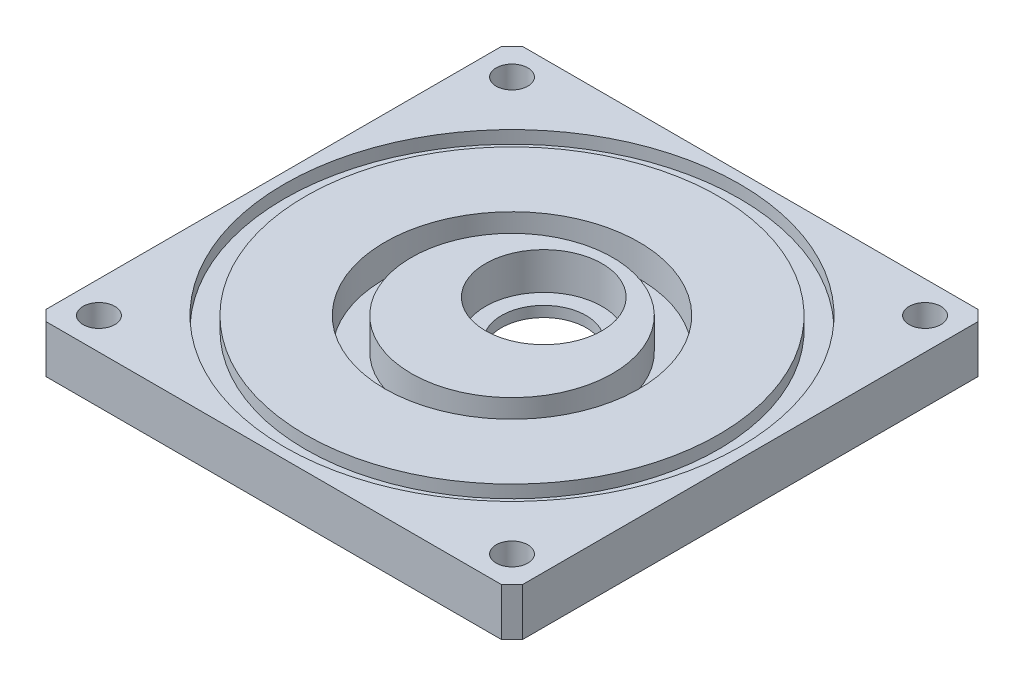
from build123d import *

# Parameters (mm, degrees)
SKETCH_1_W          = 45
SKETCH_1_H          = 45
EXTRUDE_1_DEPTH     = 4.5
SKETCH_2_R          = 5.5
CUT_EXTRUDE_1_DEPTH = 3.5
SKETCH_3_R          = 4
CUT_EXTRUDE_2_DEPTH = 33.011716605
SKETCH_4_R          = 12
SKETCH_4_R_2        = 9.5
CUT_EXTRUDE_3_DEPTH = 3
SKETCH_5_R          = 21.5
SKETCH_5_R_2        = 19.5
CUT_EXTRUDE_4_DEPTH = 1.2
CHAMFER_1_SIZE      = 1
SKETCH_6_R          = 1.5
CUT_EXTRUDE_5_DEPTH = 33.136427928


with BuildPart() as part:
    # 草图1 → 凸台-拉伸1 (new body)
    with BuildSketch(Plane(origin=(0, 0, 0), x_dir=(1, 0, 0), z_dir=(0, 1, 0))):
        Rectangle(SKETCH_1_W, SKETCH_1_H)
    extrude(amount=EXTRUDE_1_DEPTH)

    # 草图2 → 切除-拉伸1 (cut)
    with BuildSketch(Plane(origin=(0, 4.5, 0), x_dir=(1, 0, 0), z_dir=(0, 1, 0))):
        with Locations(Location((0, 3, 0), (0, 0, 270))):
            Circle(SKETCH_2_R)
    extrude(amount=-CUT_EXTRUDE_1_DEPTH, mode=Mode.SUBTRACT)

    # 草图3 → 切除-拉伸2 (cut, through all)
    with BuildSketch(Plane(origin=(0, 1, 0), x_dir=(1, 0, 0), z_dir=(0, 1, 0))):
        with Locations(Location((0, 3, 0), (0, 0, 270))):
            Circle(SKETCH_3_R)
    extrude(amount=-CUT_EXTRUDE_2_DEPTH, mode=Mode.SUBTRACT)

    # 草图4 → 切除-拉伸3 (cut)
    with BuildSketch(Plane(origin=(0, 4.5, 0), x_dir=(1, 0, 0), z_dir=(0, 1, 0))):
        with Locations(Location((0, 0, 0), (0, 0, 270))):
            Circle(SKETCH_4_R)
        with Locations(Location((0, 0, 0), (0, 0, 270))):
            Circle(SKETCH_4_R_2, mode=Mode.SUBTRACT)
    extrude(amount=-CUT_EXTRUDE_3_DEPTH, mode=Mode.SUBTRACT)

    # 草图5 → 切除-拉伸4 (cut)
    with BuildSketch(Plane(origin=(0, 4.5, 0), x_dir=(1, 0, 0), z_dir=(0, 1, 0))):
        with Locations(Location((0, 0, 0), (0, 0, 270))):
            Circle(SKETCH_5_R)
        with Locations(Location((0, 0, 0), (0, 0, 270))):
            Circle(SKETCH_5_R_2, mode=Mode.SUBTRACT)
    extrude(amount=-CUT_EXTRUDE_4_DEPTH, mode=Mode.SUBTRACT)

    # 倒角1
    chamfer_1_edges = [part.edges().sort_by_distance(p)[0] for p in [
        (22.5, 2.25, 22.5),
        (-22.5, 2.25, 22.5),
        (-22.5, 2.25, -22.5),
        (22.5, 2.25, -22.5),
    ]]
    chamfer(chamfer_1_edges, length=CHAMFER_1_SIZE)

    # 草图6 → 切除-拉伸5 (cut, through all)
    with BuildSketch(Plane.XZ):
        with Locations(Location((-19.5, 19.5, 0), (0, 0, 270))):
            Circle(SKETCH_6_R)
        with Locations(Location((19.5, 19.5, 0), (0, 0, 90))):
            Circle(SKETCH_6_R)
        with Locations(Location((19.5, -19.5, 0), (0, 0, 270))):
            Circle(SKETCH_6_R)
        with Locations(Location((-19.5, -19.5, 0), (0, 0, 90))):
            Circle(SKETCH_6_R)
    extrude(amount=-CUT_EXTRUDE_5_DEPTH, mode=Mode.SUBTRACT)


solid = part.part
